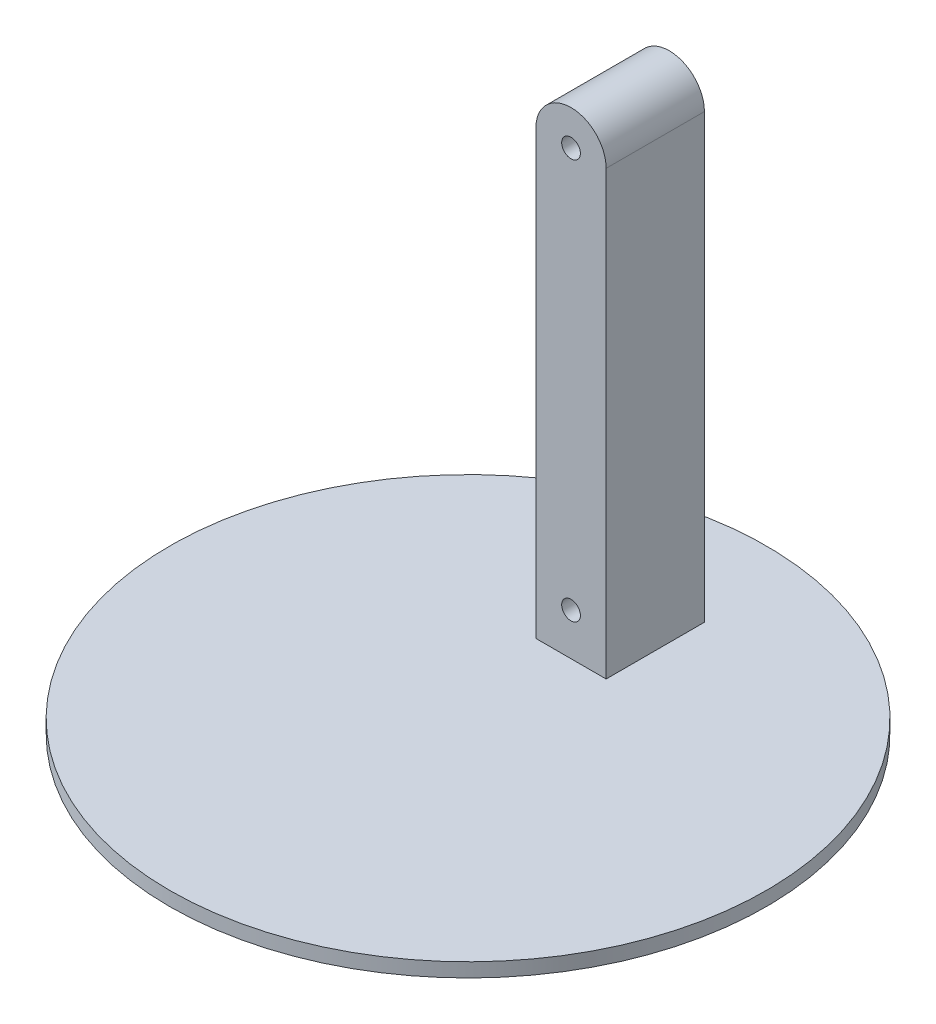
from build123d import *

# Parameters (mm, degrees)
BOSS_EXTRUDE1_START = -195
SKETCH1_R           = 127.5
BOSS_EXTRUDE1_DEPTH = 6
BOSS_EXTRUDE2_START = -65
SKETCH2_R           = 4
BOSS_EXTRUDE2_DEPTH = 21


with BuildPart() as part:
    # Sketch1 → Boss-Extrude1 (new body)
    with BuildSketch(Plane(origin=(0, 0, 0), x_dir=(1, 0, 0), z_dir=(0, 1, 0)).offset(BOSS_EXTRUDE1_START)):
        with Locations(Location((0, 0, 0), (0, 0, 270))):
            Circle(SKETCH1_R)
    extrude(amount=BOSS_EXTRUDE1_DEPTH)

    # Sketch2 → Boss-Extrude2 (add, symmetric)
    with BuildSketch(Plane.XY.offset(BOSS_EXTRUDE2_START)):
        with BuildLine():
            Line((-15, 0), (-15, -189))
            Line((-15, -189), (15, -189))
            Line((15, -189), (15, 0))
            ThreePointArc((15, 0), (0, 15), (-15, 0))
        make_face()
        with Locations(Location((0, 0, 0), (0, 0, 180))):
            Circle(SKETCH2_R, mode=Mode.SUBTRACT)
        with Locations(Location((0, -171, 0), (0, 0, 180))):
            Circle(SKETCH2_R, mode=Mode.SUBTRACT)
    extrude(amount=BOSS_EXTRUDE2_DEPTH, both=True)


solid = part.part
